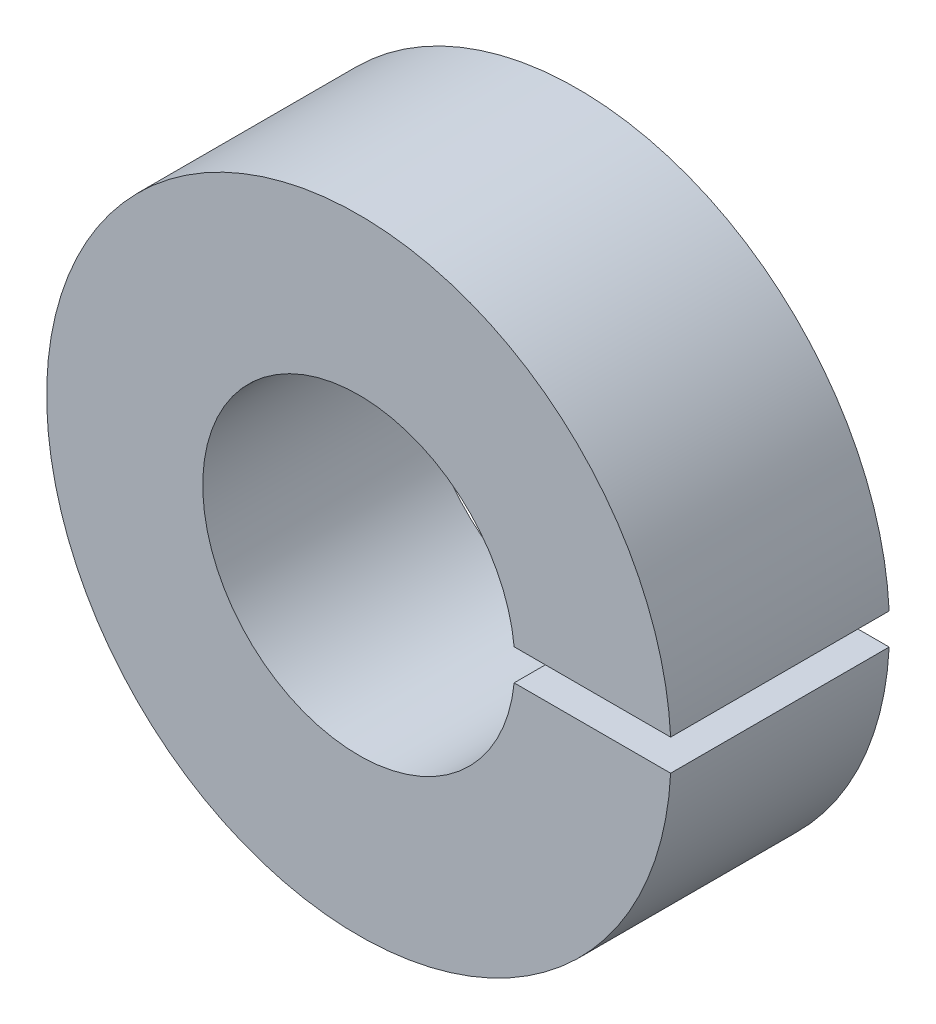
from build123d import *

# Parameters (mm, degrees)
SKETCH_1_R          = 20
SKETCH_1_R_2        = 10
EXTRUDE_1_DEPTH     = 14
SKETCH_2_W          = 12
SKETCH_2_H          = 2
CUT_EXTRUDE_1_DEPTH = 32.559467676
SKETCH_4_R          = 2.25
CUT_EXTRUDE_3_DEPTH = 14


with BuildPart() as part:
    # 草图1 → 凸台-拉伸1 (new body)
    with BuildSketch(Plane.XY.offset(-7)):
        Circle(SKETCH_1_R)
        Circle(SKETCH_1_R_2, mode=Mode.SUBTRACT)
    extrude(amount=EXTRUDE_1_DEPTH)

    # 草图2 → 切除-拉伸1 (cut, through all)
    with BuildSketch(Plane.XY.offset(-7)):
        with Locations((15, 0)):
            Rectangle(SKETCH_2_W, SKETCH_2_H)
    extrude(amount=CUT_EXTRUDE_1_DEPTH, mode=Mode.SUBTRACT)

    # 草图4 → 切除-拉伸3 (cut)
    with BuildSketch(Plane(origin=(0, -7, 0), x_dir=(1, 0, 0), z_dir=(0, 1, 0))):
        with Locations(Location((15, 0, 0), (0, 0, 270))):
            Circle(SKETCH_4_R)
    extrude(amount=CUT_EXTRUDE_3_DEPTH, mode=Mode.SUBTRACT)


solid = part.part
